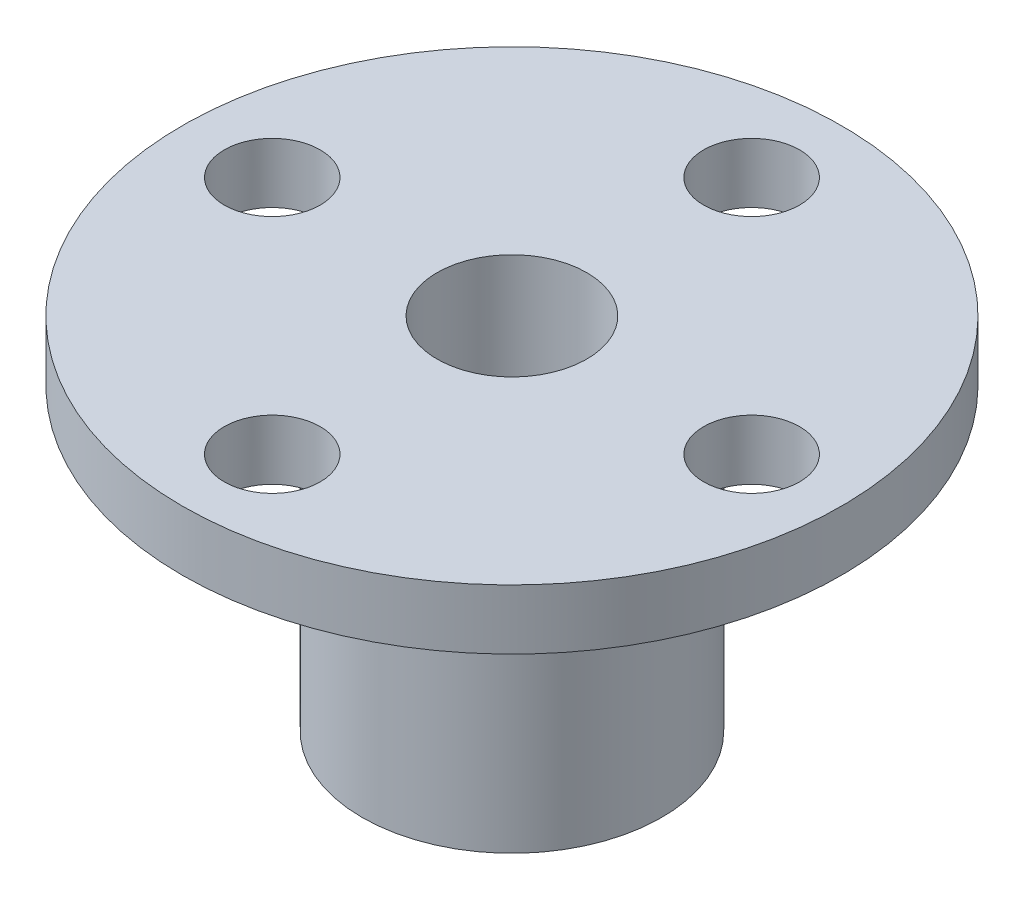
from build123d import *

# Parameters (mm, degrees)
SKETCH_1_R          = 5
EXTRUDE_1_DEPTH     = 10
SKETCH_2_R          = 11
EXTRUDE_2_DEPTH     = 2
SKETCH_3_R          = 2.5
CUT_EXTRUDE_1_DEPTH = 20.646882704
CUT_EXTRUDE_3_REACH = 20.493
SKETCH_5_R          = 1.6


with BuildPart() as part:
    # 草图1 → 凸台-拉伸1 (new body)
    with BuildSketch(Plane(origin=(0, 0, 0), x_dir=(1, 0, 0), z_dir=(0, 1, 0))):
        with Locations(Location((0, 0, 0), (0, 0, 270))):
            Circle(SKETCH_1_R)
    extrude(amount=EXTRUDE_1_DEPTH)

    # 草图2 → 凸台-拉伸2 (add)
    with BuildSketch(Plane(origin=(0, 10, 0), x_dir=(1, 0, 0), z_dir=(0, 1, 0))):
        with Locations(Location((0, 0, 0), (0, 0, 270))):
            Circle(SKETCH_2_R)
    extrude(amount=EXTRUDE_2_DEPTH)

    # 草图3 → 切除-拉伸1 (cut, through all)
    with BuildSketch(Plane.XZ):
        with Locations(Location((0, 0, 0), (0, 0, 270))):
            Circle(SKETCH_3_R)
    extrude(amount=-CUT_EXTRUDE_1_DEPTH, mode=Mode.SUBTRACT)

    # 草图5 → 切除-拉伸3 (cut, up to next)
    with BuildSketch(Plane(origin=(0, 10, 0), x_dir=(-1, 0, 0), z_dir=(0, -1, 0)), mode=Mode.PRIVATE) as cut_extrude_3_sk1:
        with Locations(Location((0, 8, 0), (0, 0, 90))):
            Circle(SKETCH_5_R)
    cut_extrude_3_tool1 = extrude(cut_extrude_3_sk1.sketch, amount=-CUT_EXTRUDE_3_REACH, mode=Mode.PRIVATE) & part.part
    # 草图5 → 切除-拉伸3 (cut, up to next)
    with BuildSketch(Plane(origin=(0, 10, 0), x_dir=(-1, 0, 0), z_dir=(0, -1, 0)), mode=Mode.PRIVATE) as cut_extrude_3_sk2:
        with Locations(Location((8, 0, 0), (0, 0, 90))):
            Circle(SKETCH_5_R)
    cut_extrude_3_tool2 = extrude(cut_extrude_3_sk2.sketch, amount=-CUT_EXTRUDE_3_REACH, mode=Mode.PRIVATE) & part.part
    # 草图5 → 切除-拉伸3 (cut, up to next)
    with BuildSketch(Plane(origin=(0, 10, 0), x_dir=(-1, 0, 0), z_dir=(0, -1, 0)), mode=Mode.PRIVATE) as cut_extrude_3_sk3:
        with Locations(Location((0, -8, 0), (0, 0, 90))):
            Circle(SKETCH_5_R)
    cut_extrude_3_tool3 = extrude(cut_extrude_3_sk3.sketch, amount=-CUT_EXTRUDE_3_REACH, mode=Mode.PRIVATE) & part.part
    # 草图5 → 切除-拉伸3 (cut, up to next)
    with BuildSketch(Plane(origin=(0, 10, 0), x_dir=(-1, 0, 0), z_dir=(0, -1, 0)), mode=Mode.PRIVATE) as cut_extrude_3_sk4:
        with Locations(Location((-8, 0, 0), (0, 0, 90))):
            Circle(SKETCH_5_R)
    cut_extrude_3_tool4 = extrude(cut_extrude_3_sk4.sketch, amount=-CUT_EXTRUDE_3_REACH, mode=Mode.PRIVATE) & part.part
    add(cut_extrude_3_tool1.solids().sort_by_distance((0, 10, -8))[0], mode=Mode.SUBTRACT)
    add(cut_extrude_3_tool2.solids().sort_by_distance((-8, 10, 0))[0], mode=Mode.SUBTRACT)
    add(cut_extrude_3_tool3.solids().sort_by_distance((0, 10, 8))[0], mode=Mode.SUBTRACT)
    add(cut_extrude_3_tool4.solids().sort_by_distance((8, 10, 0))[0], mode=Mode.SUBTRACT)


solid = part.part
